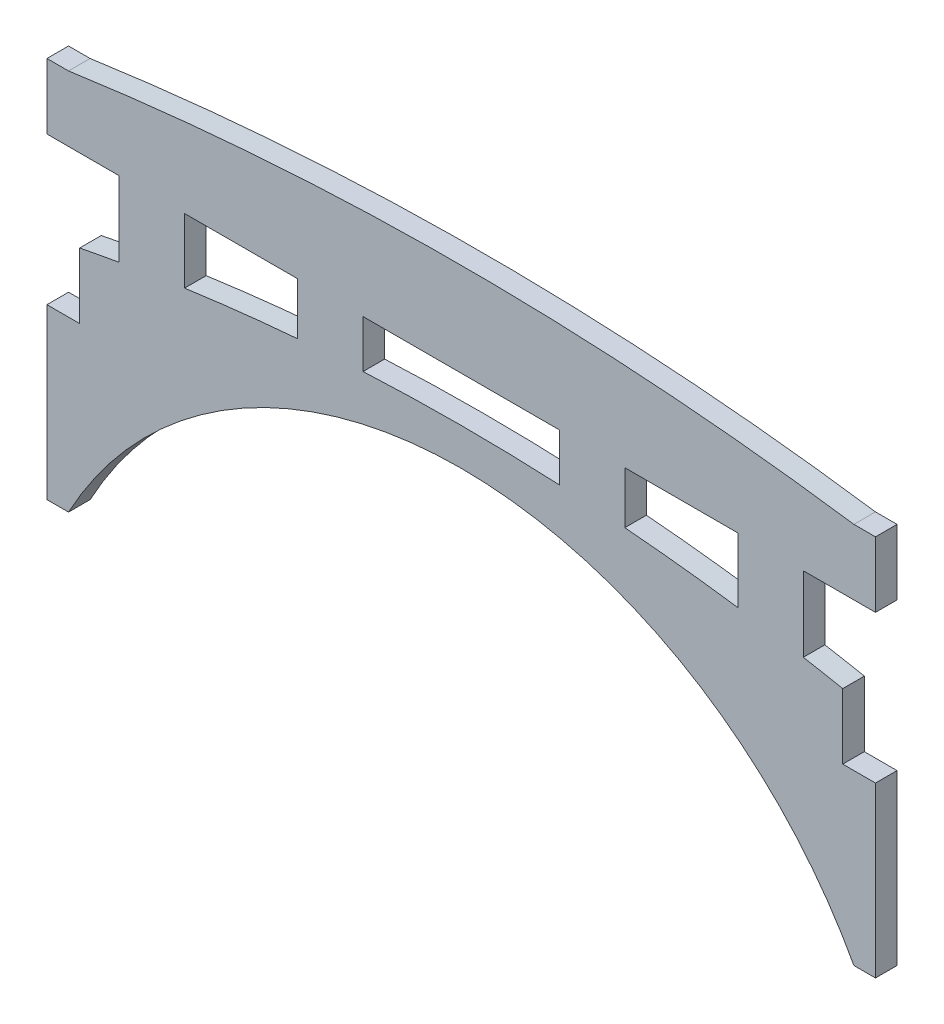
from build123d import *

# Parameters (mm, degrees)
SALIENTE_EXTRUIR1_DEPTH = 3.3


with BuildPart() as part:
    # Croquis1 → Saliente-Extruir1 (new body)
    with BuildSketch(Plane.XY):
        with BuildLine():
            Line((1.7, 25.8), (1.7, 35.8))
            ThreePointArc((1.7, 35.8), (4.712607831, 36.376098873), (7.730904305, 36.921609869))
            Line((7.730904305, 36.921609869), (7.730904305, 48.38))
            Line((7.730904305, 48.38), (1.7, 48.38))
            Line((1.7, 48.38), (-3.3, 48.38))
            Line((-3.3, 48.38), (-3.3, 58.38))
            Line((-3.3, 58.38), (0, 58.38))
            ThreePointArc((0, 58.38), (60, 62.669337163), (120, 58.38))
            Line((120, 58.38), (123.3, 58.38))
            Line((123.3, 58.38), (123.3, 48.38))
            Line((123.3, 48.38), (118.3, 48.38))
            Line((118.3, 48.38), (112.269095695, 48.38))
            Line((112.269095695, 48.38), (112.269095695, 36.921609869))
            ThreePointArc((112.269095695, 36.921609869), (115.287392169, 36.376098873), (118.3, 35.8))
            Line((118.3, 35.8), (118.3, 25.8))
            Line((118.3, 25.8), (123.3, 25.8))
            Line((123.3, 25.8), (123.3, 0))
            Line((123.3, 0), (120, 0))
            ThreePointArc((120, 0), (60, 35.797503597), (0, 0))
            Line((0, 0), (-3.3, 0))
            Line((-3.3, 0), (-3.3, 25.8))
            Line((-3.3, 25.8), (1.7, 25.8))
        make_face()
        with BuildLine():
            Line((17.730904305, 48.38), (17.730904305, 38.504540112))
            ThreePointArc((17.730904305, 38.504540112), (26.351558557, 39.595469902), (35, 40.438243974))
            Line((35, 40.438243974), (35, 48.38))
            Line((35, 48.38), (17.730904305, 48.38))
        make_face(mode=Mode.SUBTRACT)
        with BuildLine():
            Line((45, 48.38), (45, 41.101210552))
            ThreePointArc((45, 41.101210552), (60, 41.473490482), (75, 41.101210552))
            Line((75, 41.101210552), (75, 48.38))
            Line((75, 48.38), (45, 48.38))
        make_face(mode=Mode.SUBTRACT)
        with BuildLine():
            Line((85, 40.438243974), (85, 48.38))
            Line((85, 48.38), (102.269095695, 48.38))
            Line((102.269095695, 48.38), (102.269095695, 38.504540112))
            ThreePointArc((102.269095695, 38.504540112), (93.648441443, 39.595469902), (85, 40.438243974))
        make_face(mode=Mode.SUBTRACT)
    extrude(amount=SALIENTE_EXTRUIR1_DEPTH)


solid = part.part
